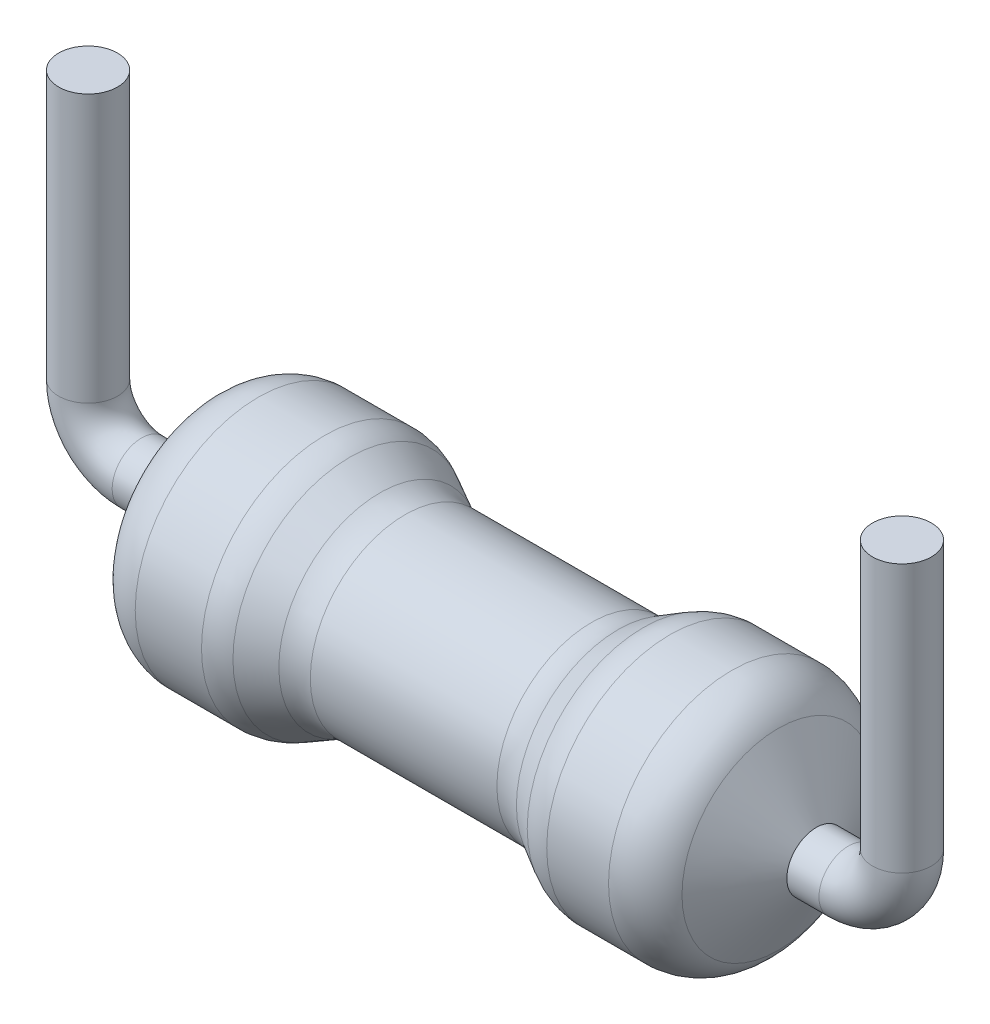
from build123d import *

# Parameters (mm, degrees)
FILLET1_R = 0.5
SKETCH4_R = 0.275


with BuildPart() as part:
    # Sketch1 → Revolve1 (revolve)
    with BuildSketch(Plane.XY, mode=Mode.PRIVATE) as revolve1_sk:
        Polygon((0, 0), (3, 0), (3, 0.275), (2.5, 1.15), (1.5, 1.15), (1.03381108, 0.883606332), (-0.96618892, 0.883606332), (-1.46618892, 1.15), (-2.5, 1.15), (-3, 0.275), (-3, 0), align=None)
    revolve(revolve1_sk.sketch.rotate(Axis((0, 0, 0), (1, 0, 0)), 90), axis=Axis((0, 0, 0), (1, 0, 0)))

    # Fillet1
    fillet1_edges = [part.edges().sort_by_distance(p)[0] for p in [
        (1.5, 0, -1.15),
        (2.5, 0, -1.15),
        (-2.5, 0, -1.15),
        (-1.46618892, 0, -1.15),
        (-0.96618892, 0, -0.883606332),
        (1.03381108, 0, -0.883606332),
    ]]
    fillet(fillet1_edges, radius=FILLET1_R)

    # Sweep1: sweep along a path in Sketch6
    with BuildLine(Plane.XY) as sweep1_path:
        Line((3.8, 3), (3.8, 0.5))
        ThreePointArc((3.8, 0.5), (3.653553391, 0.146446609), (3.3, 0))
        Line((3.3, 0), (3, 0))
        Line((3, 0), (-3.3, 0))
        ThreePointArc((-3.3, 0), (-3.653553391, 0.146446609), (-3.8, 0.5))
        Line((-3.8, 0.5), (-3.8, 3))
    # Sketch4 → Sweep1 (sweep)
    with BuildSketch(Plane(origin=(3, 0, 0), x_dir=(0, 0, -1), z_dir=(1, 0, 0))):
        Circle(SKETCH4_R)
    sweep(path=sweep1_path.line)


solid = part.part
